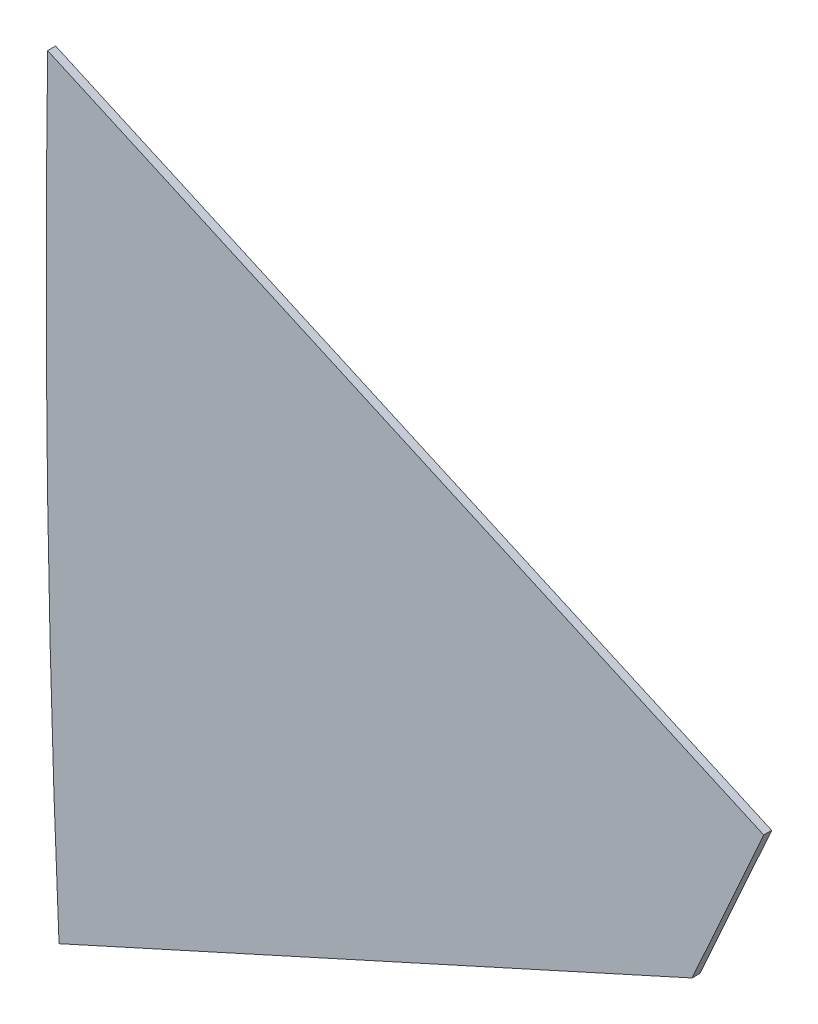
from build123d import *

# Parameters (mm, degrees)
BASE_EXTRUDE_DEPTH = 4.7752


with BuildPart() as part:
    # Sketch2 → Base-Extrude (new body)
    with BuildSketch(Plane.XY.offset(-127)):
        with BuildLine():
            Line((12.638158872, -299.265495339), (391.657215251, -127.546824726))
            Line((391.657215251, -127.546824726), (434.542341063, -31.950451317))
            Line((434.542341063, -31.950451317), (5.807090621, 160.382840206))
            ThreePointArc((5.807090621, 160.382840206), (5.755629858, -69.492852345), (12.638158872, -299.265495339))
        make_face()
    extrude(amount=BASE_EXTRUDE_DEPTH)


solid = part.part
